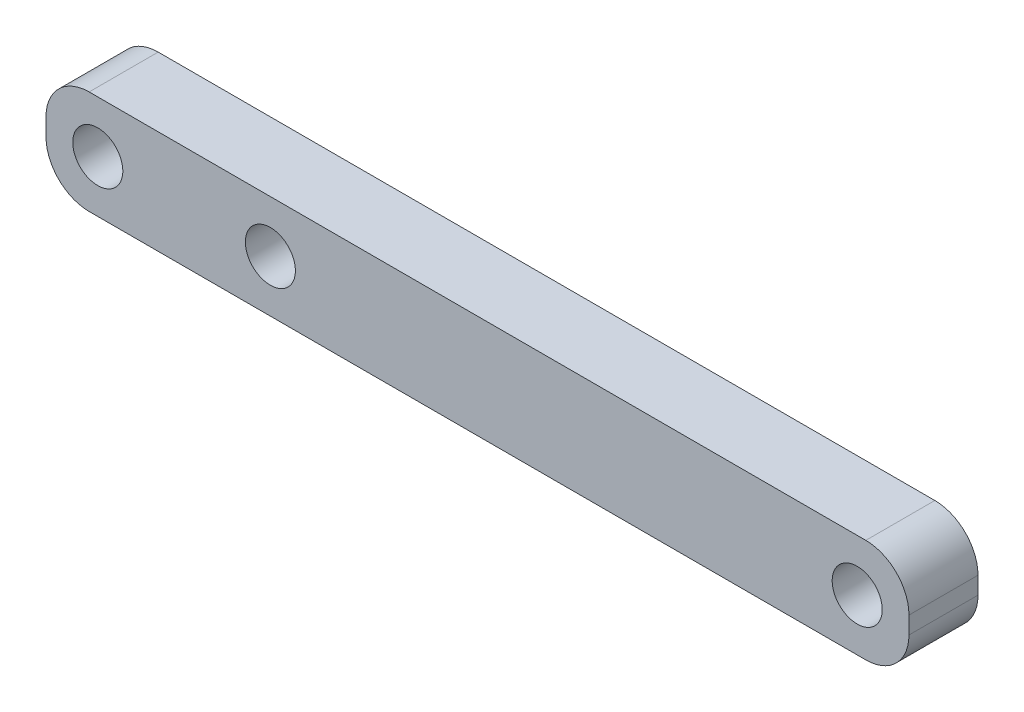
from build123d import *

# Parameters (mm, degrees)
SKETCH1_W           = 50
SKETCH1_H           = 6
BOSS_EXTRUDE1_DEPTH = 4
SKETCH2_R           = 1.45
CUT_EXTRUDE1_DEPTH  = 51.517323761
FILLET1_R           = 2.5
SKETCH3_R           = 1.45
CUT_EXTRUDE2_DEPTH  = 51.517323761


with BuildPart() as part:
    # Sketch1 → Boss-Extrude1 (new body)
    with BuildSketch(Plane.XY):
        with Locations((-25, -3)):
            Rectangle(SKETCH1_W, SKETCH1_H)
    extrude(amount=BOSS_EXTRUDE1_DEPTH)

    # Sketch2 → Cut-Extrude1 (cut, through all)
    with BuildSketch(Plane(origin=(0, 0, 0), x_dir=(-1, 0, 0), z_dir=(0, 0, -1))):
        with Locations((3, -3)):
            Circle(SKETCH2_R)
        with Locations((37, -3)):
            Circle(SKETCH2_R)
    extrude(amount=-CUT_EXTRUDE1_DEPTH, mode=Mode.SUBTRACT)

    # Fillet1
    fillet1_edges = [part.edges().sort_by_distance(p)[0] for p in [
        (0, -6, 2),
        (-50, -6, 2),
        (-50, 0, 2),
        (0, 0, 2),
    ]]
    fillet(fillet1_edges, radius=FILLET1_R)

    # Sketch3 → Cut-Extrude2 (cut, through all)
    with BuildSketch(Plane(origin=(0, 0, 0), x_dir=(-1, 0, 0), z_dir=(0, 0, -1))):
        with Locations((47, -3)):
            Circle(SKETCH3_R)
    extrude(amount=-CUT_EXTRUDE2_DEPTH, mode=Mode.SUBTRACT)


solid = part.part
